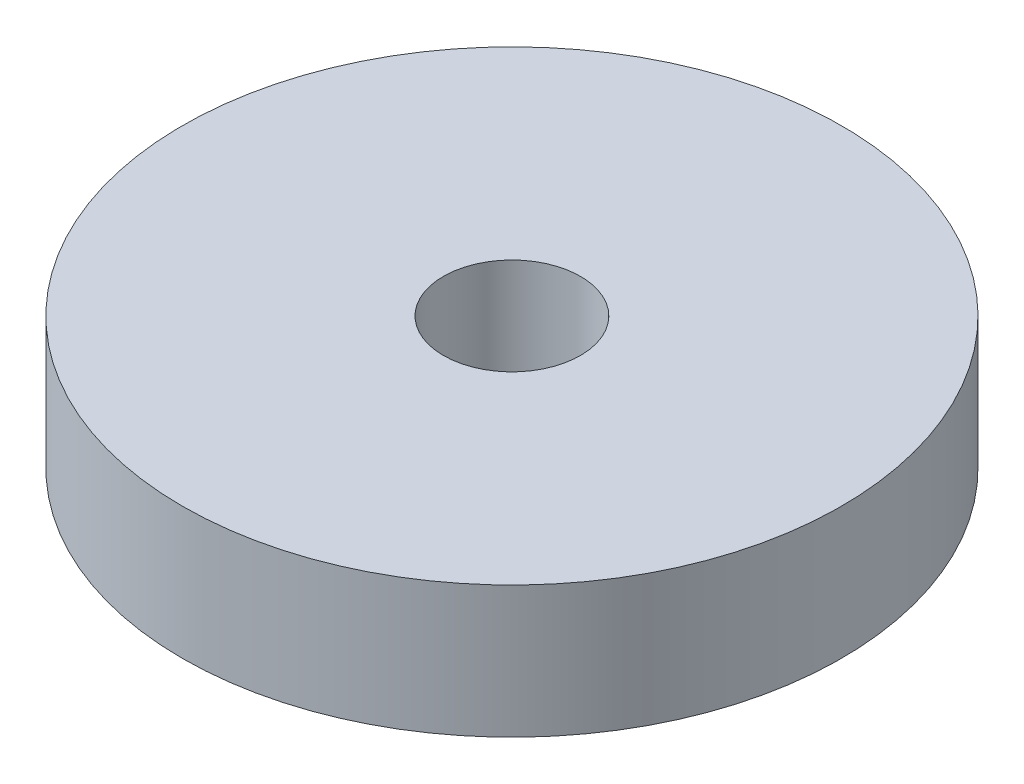
from build123d import *

# Parameters (mm, degrees)
SKETCH1_R           = 12.5
SKETCH1_R_2         = 2.6
BOSS_EXTRUDE1_DEPTH = 5


with BuildPart() as part:
    # Sketch1 → Boss-Extrude1 (new body)
    with BuildSketch(Plane(origin=(0, 0, 0), x_dir=(1, 0, 0), z_dir=(0, 1, 0))):
        with Locations(Location((0, 0, 0), (0, 0, 270))):
            Circle(SKETCH1_R)
        with Locations(Location((0, 0, 0), (0, 0, 270))):
            Circle(SKETCH1_R_2, mode=Mode.SUBTRACT)
    extrude(amount=BOSS_EXTRUDE1_DEPTH)


solid = part.part
